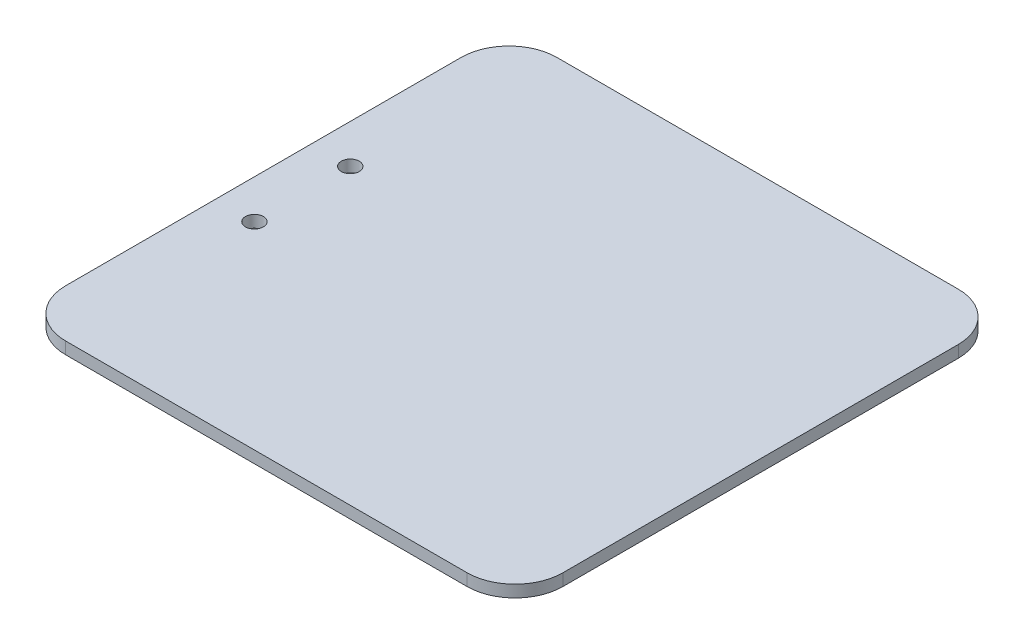
from build123d import *

# Parameters (mm, degrees)
SKETCH1_R           = 1.5
BOSS_EXTRUDE1_DEPTH = 2


with BuildPart() as part:
    # Sketch1 → Boss-Extrude1 (new body)
    with BuildSketch(Plane(origin=(0, 0, 0), x_dir=(1, 0, 0), z_dir=(0, 1, 0))):
        with BuildLine():
            Line((8, 0), (75, 0))
            ThreePointArc((75, 0), (80.656854249, 2.343145751), (83, 8))
            Line((83, 8), (83, 74))
            ThreePointArc((83, 74), (80.656854249, 79.656854249), (75, 82))
            Line((75, 82), (8, 82))
            ThreePointArc((8, 82), (2.343145751, 79.656854249), (0, 74))
            Line((0, 74), (0, 8))
            ThreePointArc((0, 8), (2.343145751, 2.343145751), (8, 0))
        make_face()
        with Locations(Location((6.5, 49, 0), (0, 0, 270))):
            Circle(SKETCH1_R, mode=Mode.SUBTRACT)
        with Locations(Location((6.5, 33, 0), (0, 0, 90))):
            Circle(SKETCH1_R, mode=Mode.SUBTRACT)
    extrude(amount=BOSS_EXTRUDE1_DEPTH)


solid = part.part
